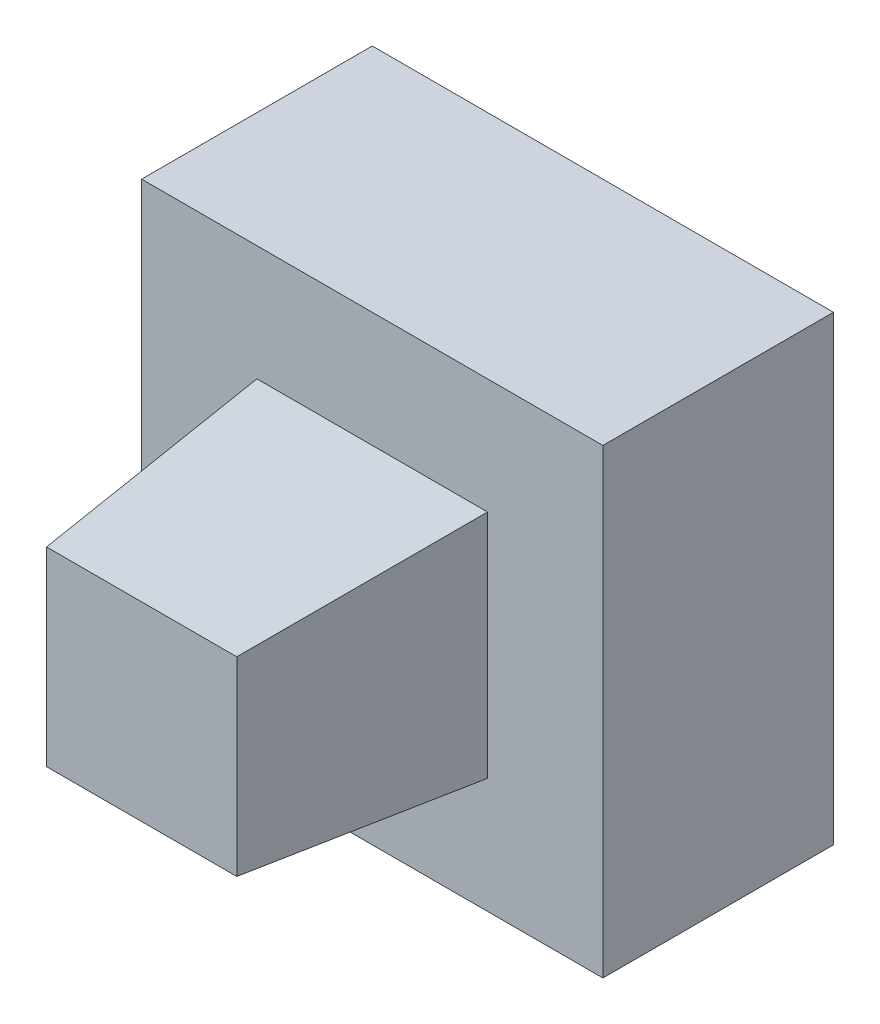
from build123d import *

# Parameters (mm, degrees)
SKETCH_1_W         = 20
SKETCH_1_H         = 20
BASEBOX_DEPTH      = 10
SKETCH_2_W         = 10
SKETCH_2_H         = 10
DRAFTOUTWARD_DEPTH = 10
DRAFTOUTWARD_TAPER = 5


with BuildPart() as part:
    # 草图1 → BaseBox (new body)
    with BuildSketch(Plane.XY):
        with Locations((10, 10)):
            Rectangle(SKETCH_1_W, SKETCH_1_H)
    extrude(amount=BASEBOX_DEPTH)

    # 草图2 → DraftOutward (add)
    with BuildSketch(Plane.XY.offset(10)):
        with Locations((10, 10)):
            Rectangle(SKETCH_2_W, SKETCH_2_H)
    extrude(amount=DRAFTOUTWARD_DEPTH, taper=DRAFTOUTWARD_TAPER)


solid = part.part
